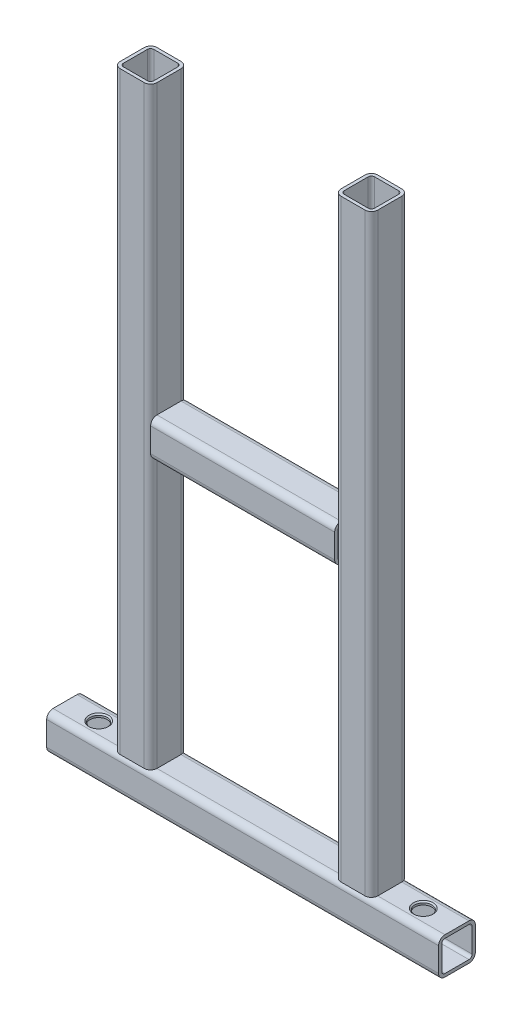
from build123d import *

# Parameters (mm, degrees)
SQUARE_TUBE_30_X_30_X_2_6_1_DEPTH   = 501
SQUARE_TUBE_30_X_30_X_2_6_1_2_DEPTH = 501
SQUARE_TUBE_30_X_30_X_2_6_1_3_DEPTH = 320
SQUARE_TUBE_30_X_30_X_2_6_1_4_DEPTH = 182.26


with BuildPart() as part:
    # Sketch17 → Square tube 30 X 30 X 2.6(1) (new body)
    with BuildSketch(Plane(origin=(-90.13, 0, 0), x_dir=(1, 0, 0), z_dir=(0, -1, 0))):
        with BuildLine():
            Line((-9.8, -15), (9.8, -15))
            ThreePointArc((9.8, -15), (13.476955262, -13.476955262), (15, -9.8))
            Line((15, -9.8), (15, 9.8))
            ThreePointArc((15, 9.8), (13.476955262, 13.476955262), (9.8, 15))
            Line((9.8, 15), (-9.8, 15))
            ThreePointArc((-9.8, 15), (-13.476955262, 13.476955262), (-15, 9.8))
            Line((-15, 9.8), (-15, -9.8))
            ThreePointArc((-15, -9.8), (-13.476955262, -13.476955262), (-9.8, -15))
        make_face()
        with BuildLine():
            Line((-9.8, -12.4), (9.8, -12.4))
            ThreePointArc((9.8, -12.4), (11.638477631, -11.638477631), (12.4, -9.8))
            Line((12.4, -9.8), (12.4, 9.8))
            ThreePointArc((12.4, 9.8), (11.638477631, 11.638477631), (9.8, 12.4))
            Line((9.8, 12.4), (-9.8, 12.4))
            ThreePointArc((-9.8, 12.4), (-11.638477631, 11.638477631), (-12.4, 9.8))
            Line((-12.4, 9.8), (-12.4, -9.8))
            ThreePointArc((-12.4, -9.8), (-11.638477631, -11.638477631), (-9.8, -12.4))
        make_face(mode=Mode.SUBTRACT)
    extrude(amount=SQUARE_TUBE_30_X_30_X_2_6_1_DEPTH)

    # Square tube 30 X 30 X 2.6(1) end butt 1
    split(bisect_by=Plane(origin=(-90.13, -485, 0), x_dir=(-1, 0, 0), z_dir=(0, 1, 0)), keep=Keep.TOP)


with BuildPart() as body_2:
    # Sketch17 on segment 2 (carried to segment 2) → Square tube 30 X 30 X 2.6_1 2 (new body)
    with BuildSketch(Plane(origin=(90.13, 0, 0), x_dir=(1, 0, 0), z_dir=(0, -1, 0))):
        with BuildLine():
            Line((-9.8, -15), (9.8, -15))
            ThreePointArc((9.8, -15), (13.476955262, -13.476955262), (15, -9.8))
            Line((15, -9.8), (15, 9.8))
            ThreePointArc((15, 9.8), (13.476955262, 13.476955262), (9.8, 15))
            Line((9.8, 15), (-9.8, 15))
            ThreePointArc((-9.8, 15), (-13.476955262, 13.476955262), (-15, 9.8))
            Line((-15, 9.8), (-15, -9.8))
            ThreePointArc((-15, -9.8), (-13.476955262, -13.476955262), (-9.8, -15))
        make_face()
        with BuildLine():
            Line((-9.8, -12.4), (9.8, -12.4))
            ThreePointArc((9.8, -12.4), (11.638477631, -11.638477631), (12.4, -9.8))
            Line((12.4, -9.8), (12.4, 9.8))
            ThreePointArc((12.4, 9.8), (11.638477631, 11.638477631), (9.8, 12.4))
            Line((9.8, 12.4), (-9.8, 12.4))
            ThreePointArc((-9.8, 12.4), (-11.638477631, 11.638477631), (-12.4, 9.8))
            Line((-12.4, 9.8), (-12.4, -9.8))
            ThreePointArc((-12.4, -9.8), (-11.638477631, -11.638477631), (-9.8, -12.4))
        make_face(mode=Mode.SUBTRACT)
    extrude(amount=SQUARE_TUBE_30_X_30_X_2_6_1_2_DEPTH)

    # Square tube 30 X 30 X 2.6_1 2 end butt 1
    split(bisect_by=Plane(origin=(90.13, -485, 0), x_dir=(-1, 0, 0), z_dir=(0, 1, 0)), keep=Keep.TOP)


with BuildPart() as body_3:
    # Sketch17 on segment 3 (carried to segment 3) → Square tube 30 X 30 X 2.6_1 3 (new body)
    with BuildSketch(Plane(origin=(-160, -500, 0), x_dir=(0, 1, 0), z_dir=(1, 0, 0))):
        with BuildLine():
            Line((-9.8, -15), (9.8, -15))
            ThreePointArc((9.8, -15), (13.476955262, -13.476955262), (15, -9.8))
            Line((15, -9.8), (15, 9.8))
            ThreePointArc((15, 9.8), (13.476955262, 13.476955262), (9.8, 15))
            Line((9.8, 15), (-9.8, 15))
            ThreePointArc((-9.8, 15), (-13.476955262, 13.476955262), (-15, 9.8))
            Line((-15, 9.8), (-15, -9.8))
            ThreePointArc((-15, -9.8), (-13.476955262, -13.476955262), (-9.8, -15))
        make_face()
        with BuildLine():
            Line((-9.8, -12.4), (9.8, -12.4))
            ThreePointArc((9.8, -12.4), (11.638477631, -11.638477631), (12.4, -9.8))
            Line((12.4, -9.8), (12.4, 9.8))
            ThreePointArc((12.4, 9.8), (11.638477631, 11.638477631), (9.8, 12.4))
            Line((9.8, 12.4), (-9.8, 12.4))
            ThreePointArc((-9.8, 12.4), (-11.638477631, 11.638477631), (-12.4, 9.8))
            Line((-12.4, 9.8), (-12.4, -9.8))
            ThreePointArc((-12.4, -9.8), (-11.638477631, -11.638477631), (-9.8, -12.4))
        make_face(mode=Mode.SUBTRACT)
    extrude(amount=SQUARE_TUBE_30_X_30_X_2_6_1_3_DEPTH)

    # Sketch19 → M16 Tapped Hole1 (revolve, cut)
    with BuildSketch(Plane(origin=(-132.565, -485, 0), x_dir=(0, 0, 1), z_dir=(1, 0, 0))):
        Polygon((0, 0), (0, 42.206024333), (7, 38), (7, 1.025), (8.025, 0), align=None)
    m16_tapped_hole1 = revolve(axis=Axis((-132.565, -478.65, 0), (0, -1, 0)), mode=Mode.SUBTRACT)

    # Mirror1: M16 Tapped Hole1 across plane
    add(m16_tapped_hole1.mirror(Plane(origin=(0, 0, 0), x_dir=(0, 0, 1), z_dir=(1, 0, 0))), mode=Mode.SUBTRACT)


with BuildPart() as body_4:
    # Sketch17 on segment 4 (carried to segment 4) → Square tube 30 X 30 X 2.6_1 4 (new body)
    with BuildSketch(Plane(origin=(-91.13, -250, 0), x_dir=(0, 1, 0), z_dir=(1, 0, 0))):
        with BuildLine():
            Line((-9.8, -15), (9.8, -15))
            ThreePointArc((9.8, -15), (13.476955262, -13.476955262), (15, -9.8))
            Line((15, -9.8), (15, 9.8))
            ThreePointArc((15, 9.8), (13.476955262, 13.476955262), (9.8, 15))
            Line((9.8, 15), (-9.8, 15))
            ThreePointArc((-9.8, 15), (-13.476955262, 13.476955262), (-15, 9.8))
            Line((-15, 9.8), (-15, -9.8))
            ThreePointArc((-15, -9.8), (-13.476955262, -13.476955262), (-9.8, -15))
        make_face()
        with BuildLine():
            Line((-9.8, -12.4), (9.8, -12.4))
            ThreePointArc((9.8, -12.4), (11.638477631, -11.638477631), (12.4, -9.8))
            Line((12.4, -9.8), (12.4, 9.8))
            ThreePointArc((12.4, 9.8), (11.638477631, 11.638477631), (9.8, 12.4))
            Line((9.8, 12.4), (-9.8, 12.4))
            ThreePointArc((-9.8, 12.4), (-11.638477631, 11.638477631), (-12.4, 9.8))
            Line((-12.4, 9.8), (-12.4, -9.8))
            ThreePointArc((-12.4, -9.8), (-11.638477631, -11.638477631), (-9.8, -12.4))
        make_face(mode=Mode.SUBTRACT)
    extrude(amount=SQUARE_TUBE_30_X_30_X_2_6_1_4_DEPTH)

    # Square tube 30 X 30 X 2.6_1 4 end butt 1
    split(bisect_by=Plane(origin=(-75.13, -250, 0), x_dir=(0, 1, 0), z_dir=(1, 0, 0)), keep=Keep.TOP)

    # Square tube 30 X 30 X 2.6_1 4 end butt 2
    split(bisect_by=Plane(origin=(75.13, -250, 0), x_dir=(0, -1, 0), z_dir=(-1, 0, 0)), keep=Keep.TOP)


solid = Compound([part.part, body_2.part, body_3.part, body_4.part])
